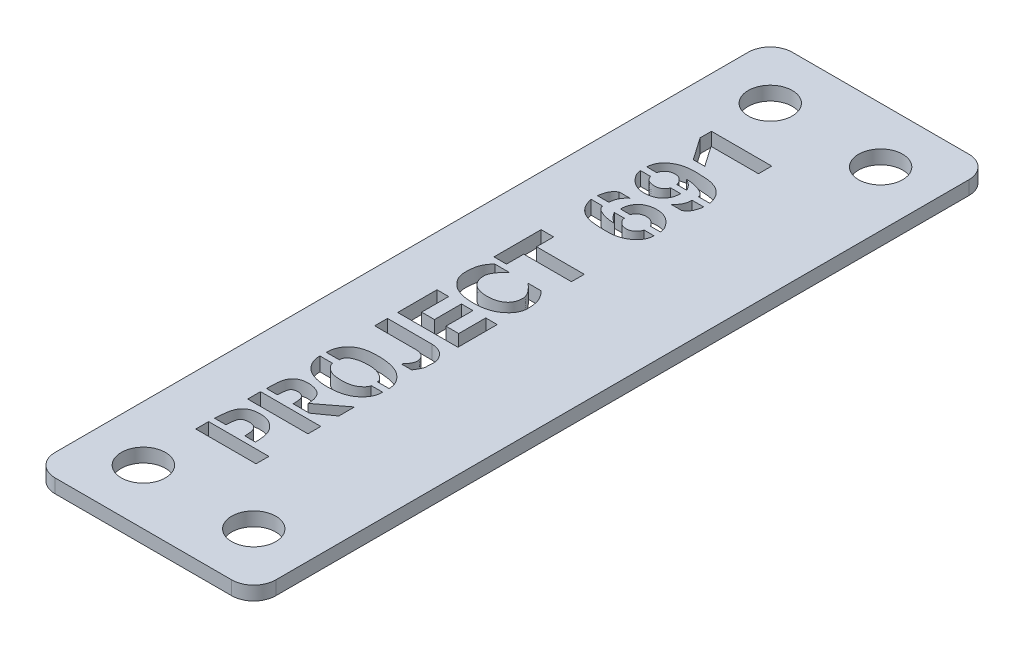
from build123d import *

# Parameters (mm, degrees)
SKETCH1_W           = 25.4
SKETCH1_H           = 84.836
BOSS_EXTRUDE1_DEPTH = 1.5875
FILLET1_R           = 2.54
SKETCH2_R           = 2.54
CUT_EXTRUDE1_DEPTH  = 4.7625
SKETCH3_W           = 6.937209635
SKETCH3_H           = 1.47773099
SKETCH3_H_2         = 1.477730989
CUT_EXTRUDE3_DEPTH  = 4.7625


with BuildPart() as part:
    # Sketch1 → Boss-Extrude1 (new body)
    with BuildSketch(Plane(origin=(0, 0, 0), x_dir=(1, 0, 0), z_dir=(0, 1, 0))):
        Rectangle(SKETCH1_W, SKETCH1_H)
    extrude(amount=BOSS_EXTRUDE1_DEPTH)

    # Fillet1
    fillet1_edges = [part.edges().sort_by_distance(p)[0] for p in [
        (-12.7, 0.79375, -42.418),
        (12.7, 0.79375, -42.418),
        (12.7, 0.79375, 42.418),
        (-12.7, 0.79375, 42.418),
    ]]
    fillet(fillet1_edges, radius=FILLET1_R)

    # Sketch2 → Cut-Extrude1 (cut)
    with BuildSketch(Plane(origin=(0, 1.5875, 0), x_dir=(1, 0, 0), z_dir=(0, 1, 0))):
        with Locations(Location((6.35, 36.068, 0), (0, 0, 270))):
            Circle(SKETCH2_R)
        with Locations(Location((-6.35, 36.068, 0), (0, 0, 270))):
            Circle(SKETCH2_R)
        with Locations(Location((6.35, -36.068, 0), (0, 0, 270))):
            Circle(SKETCH2_R)
        with Locations(Location((-6.35, -36.068, 0), (0, 0, 270))):
            Circle(SKETCH2_R)
    extrude(amount=-CUT_EXTRUDE1_DEPTH, mode=Mode.SUBTRACT)

    # Sketch3 → Cut-Extrude3 (cut)
    with BuildSketch(Plane(origin=(0, 1.5875, 0), x_dir=(1, 0, 0), z_dir=(0, 1, 0))):
        with BuildLine():
            Line((-2.204557943, -27.318811646), (-3.432489193, -27.318811646))
            add(Edge.make_bspline(
                [(-3.432489193, -27.318811646), (-3.432086244, -27.242043489), (-3.43131662, -27.095417788), (-3.444434951, -26.885090985), (-3.462893716, -26.694079451), (-3.490651172, -26.521824011), (-3.529286887, -26.369068947), (-3.578036003, -26.235963855), (-3.631503271, -26.119599112), (-3.700606609, -26.024876261), (-3.774751798, -25.94326573), (-3.859309551, -25.875236157), (-3.951313004, -25.81606595), (-4.052326275, -25.767662454), (-4.162419043, -25.732227657), (-4.279993593, -25.704130858), (-4.407280254, -25.690675175), (-4.539497775, -25.684071819), (-4.67120632, -25.68931151), (-4.795938487, -25.700663902), (-4.911135214, -25.720321161), (-5.01728325, -25.746758344), (-5.113551653, -25.782898874), (-5.20018799, -25.826377302), (-5.276644926, -25.878356426), (-5.345910846, -25.939667647), (-5.405748322, -26.021181454), (-5.455121107, -26.126788682), (-5.500796447, -26.257094486), (-5.534324196, -26.415150462), (-5.566678309, -26.59815323), (-5.589264627, -26.808329507), (-5.607848058, -27.044153478), (-5.613179732, -27.210425561), (-5.615979687, -27.297744198)],
                knots=[0, 0, 0, 0, 1.620059853, 3.094283102, 4.446036624, 5.669764395, 6.774058916, 7.765531304, 8.660548686, 9.465545705, 10.229819932, 10.982267153, 11.748884886, 12.535069155, 13.338672239, 14.18627352, 15.081979594, 16.035876351, 16.978779197, 17.861689262, 18.67809544, 19.443395835, 20.167134492, 20.8442956, 21.484521806, 22.114153355, 22.787578946, 23.602060283, 24.566476989, 25.696612031, 27.007394411, 28.488900441, 30.156128049, 32, 32, 32, 32], degree=3))
            Line((-5.615979687, -27.297744198), (-6.926675911, -27.297744198))
            add(Edge.make_bspline(
                [(-6.926675911, -27.297744198), (-6.921712564, -27.18334754), (-6.912149702, -26.962939926), (-6.889474751, -26.645831121), (-6.861772416, -26.354612775), (-6.825780895, -26.090107298), (-6.783941902, -25.851579213), (-6.736724336, -25.638719824), (-6.681792385, -25.45199614), (-6.619050018, -25.289274235), (-6.549930048, -25.145269935), (-6.475368605, -25.013851842), (-6.391670351, -24.895266674), (-6.304488565, -24.785514263), (-6.20972416, -24.687152478), (-6.106551853, -24.601539985), (-5.998363784, -24.525480797), (-5.84144082, -24.439916569), (-5.624638239, -24.353975928), (-5.338004568, -24.280368922), (-5.019882446, -24.239015253), (-4.73772238, -24.225933909), (-4.503107017, -24.233735716), (-4.327486567, -24.249429272), (-4.156796234, -24.278965653), (-3.990195633, -24.3168429), (-3.8297448, -24.371191099), (-3.672415085, -24.431572528), (-3.521002812, -24.506675475), (-3.374664778, -24.591583863), (-3.235441884, -24.686356673), (-3.104154991, -24.787205163), (-2.981621264, -24.89435255), (-2.868204891, -25.008408891), (-2.766398735, -25.131578913), (-2.670787271, -25.258608179), (-2.586590412, -25.394214474), (-2.508470134, -25.536587596), (-2.43904046, -25.693136489), (-2.382088863, -25.868028067), (-2.330052116, -26.061697568), (-2.28953676, -26.275159671), (-2.254184606, -26.507963608), (-2.229965258, -26.760683599), (-2.211124708, -27.033142019), (-2.206795653, -27.221466011), (-2.204557943, -27.318811646)],
                knots=[0, 0, 0, 0, 1.699189764, 3.273822559, 4.717445749, 6.039702003, 7.234168391, 8.310453345, 9.273716079, 10.119740721, 10.895518061, 11.642474635, 12.359027655, 13.047258987, 13.721088708, 14.381587928, 15.034110984, 15.680490903, 17.029629755, 18.483046039, 20.061106175, 21.782264105, 22.668591867, 23.543372224, 24.396343774, 25.237738208, 26.075767183, 26.907923794, 27.736877995, 28.580804131, 29.416979643, 30.23438941, 31.03619414, 31.831023051, 32.618286661, 33.405866943, 34.188612909, 34.984695714, 35.814585228, 36.725577301, 37.711441232, 38.788832536, 39.947912176, 41.204878494, 42.555187395, 44, 44, 44, 44], degree=3))
        make_face()
        with Locations((-3.468604818, -28.712272844)):
            Rectangle(SKETCH3_W, SKETCH3_H)
        with Locations((-3.468604818, -22.741156178)):
            Rectangle(SKETCH3_W, SKETCH3_H_2)
        with BuildLine():
            add(Edge.make_bspline(
                [(-3.84781888, -21.337161256), (-3.847753872, -21.265926003), (-3.847629287, -21.129407572), (-3.856412298, -20.93355259), (-3.873130803, -20.756378239), (-3.89422301, -20.597685736), (-3.925514345, -20.458660199), (-3.964855298, -20.338957205), (-4.008862139, -20.236185284), (-4.063781239, -20.151428397), (-4.128253534, -20.083185163), (-4.195373034, -20.020966344), (-4.273923765, -19.972273328), (-4.358233929, -19.928678985), (-4.451978172, -19.898349054), (-4.552643244, -19.875213633), (-4.66106172, -19.862255319), (-4.774288702, -19.857911775), (-4.88643986, -19.862473824), (-4.992170249, -19.874073649), (-5.088903823, -19.893580882), (-5.176763692, -19.919831106), (-5.254934344, -19.956278497), (-5.322499717, -20.001998193), (-5.382848358, -20.053485938), (-5.434618007, -20.116041305), (-5.477796034, -20.195189439), (-5.513801737, -20.29396158), (-5.548974097, -20.41391277), (-5.577494774, -20.55710614), (-5.604854555, -20.722633409), (-5.626833921, -20.910969515), (-5.644452056, -21.121798523), (-5.65341092, -21.269924536), (-5.658114583, -21.34769498)],
                knots=[0, 0, 0, 0, 1.704020633, 3.265661473, 4.687782663, 5.960558721, 7.092940044, 8.090949425, 8.971855951, 9.760657708, 10.491171539, 11.213658047, 11.942593241, 12.693902549, 13.479411519, 14.291598235, 15.162311024, 16.087000325, 16.999698994, 17.845156185, 18.628829851, 19.357567475, 20.033937485, 20.682928481, 21.303797403, 21.926056331, 22.613721948, 23.449414641, 24.436762231, 25.60173672, 26.93927573, 28.450017959, 30.1361567, 32, 32, 32, 32], degree=3))
            Line((-5.658114583, -21.34769498), (-6.907113281, -21.34769498))
            add(Edge.make_bspline(
                [(-6.907113281, -21.34769498), (-6.90682114, -21.22980228), (-6.906261587, -21.003997057), (-6.894238821, -20.680482609), (-6.881787593, -20.38717533), (-6.856193437, -20.1249368), (-6.829476564, -19.892639907), (-6.793612056, -19.691165929), (-6.752510206, -19.519862307), (-6.68978001, -19.334857686), (-6.588099061, -19.139505957), (-6.442249963, -18.935053685), (-6.263862306, -18.767229212), (-6.060311779, -18.632384798), (-5.834664977, -18.53161419), (-5.593774188, -18.45675038), (-5.337194887, -18.413966326), (-5.069279876, -18.399775581), (-4.797286243, -18.412218728), (-4.527748811, -18.448112576), (-4.264957544, -18.509025033), (-4.051778129, -18.577795298), (-3.888464716, -18.647363989), (-3.773840392, -18.708883966), (-3.667821705, -18.780352169), (-3.569622631, -18.859951386), (-3.480426153, -18.949258895), (-3.399855969, -19.048142343), (-3.328371497, -19.156577345), (-3.240615154, -19.313216413), (-3.153034087, -19.528605262), (-3.080046601, -19.808970902), (-3.033969671, -20.11273115), (-3.028839124, -20.323744903), (-3.026188411, -20.432765813)],
                knots=[0, 0, 0, 0, 1.545689895, 2.960529795, 4.244762436, 5.394017444, 6.414580785, 7.309945393, 8.075641602, 8.72251512, 9.866752923, 10.949451079, 12.000892828, 13.058917368, 14.136147873, 15.230450672, 16.35823801, 17.537386422, 18.742157286, 19.923486542, 21.0977639, 22.274984682, 22.855342685, 23.423306737, 23.977859707, 24.529479651, 25.078269143, 25.629889087, 26.199032476, 26.779092248, 27.98221028, 29.234586207, 30.571240389, 32, 32, 32, 32], degree=3))
            Line((-3.026188411, -20.432765813), (0, -18.122870631))
            Line((0, -18.122870631), (0, -19.933166334))
            Line((0, -19.933166334), (-1.986359375, -21.337161256))
            Line((-1.986359375, -21.337161256), (-3.84781888, -21.337161256))
        make_face()
        with BuildLine():
            add(Edge.make_bspline(
                [(-1.17526263, -14.302138469), (-1.176933137, -14.270320689), (-1.180340607, -14.205419324), (-1.211408481, -14.10939091), (-1.259105899, -14.013500009), (-1.324990391, -13.916470126), (-1.409867757, -13.818610025), (-1.514991417, -13.721397576), (-1.636947573, -13.622137312), (-1.775605988, -13.523710973), (-1.92952388, -13.430176335), (-2.099041038, -13.349129248), (-2.280756724, -13.280266035), (-2.47540848, -13.223881852), (-2.682505224, -13.183037248), (-2.902068659, -13.152836031), (-3.134201346, -13.134649564), (-3.375341466, -13.131311582), (-3.61626525, -13.137306834), (-3.848870711, -13.15140983), (-4.068120674, -13.177746639), (-4.275819162, -13.210050723), (-4.471102199, -13.252966051), (-4.653462371, -13.308176594), (-4.824324934, -13.368543178), (-4.980858056, -13.440815051), (-5.121393437, -13.521277307), (-5.245691328, -13.608116842), (-5.348101515, -13.705591479), (-5.434800426, -13.808282107), (-5.500001896, -13.920980862), (-5.545735921, -14.041376551), (-5.571841994, -14.169580802), (-5.57416518, -14.25737723), (-5.575349609, -14.302138469)],
                knots=[0, 0, 0, 0, 0.559551673, 1.141363957, 1.762179237, 2.443913102, 3.20250351, 4.040654274, 4.964481152, 5.97279125, 7.03575374, 8.135123237, 9.279679308, 10.457759393, 11.702785314, 12.996979229, 14.362738502, 15.804190176, 17.245831659, 18.610331059, 19.909950123, 21.136790735, 22.314472596, 23.430673126, 24.493525292, 25.506283696, 26.464789682, 27.34564422, 28.171296493, 28.950175142, 29.70690828, 30.454076609, 31.211842126, 32, 32, 32, 32], degree=3))
            Line((-5.575349609, -14.302138469), (-7.072643229, -14.302138469))
            add(Edge.make_bspline(
                [(-7.072643229, -14.302138469), (-7.070053996, -14.205688359), (-7.064974851, -14.016487887), (-7.024691446, -13.739763459), (-6.960781089, -13.476069688), (-6.868281915, -13.22693284), (-6.750778594, -12.991505893), (-6.604026538, -12.772136693), (-6.433764246, -12.565290762), (-6.236821326, -12.372530739), (-6.01076592, -12.197738151), (-5.750124588, -12.051409606), (-5.460800465, -11.924891132), (-5.13802578, -11.827830796), (-4.785007759, -11.750581216), (-4.399835445, -11.701093834), (-3.983692041, -11.674714797), (-3.546103019, -11.672385111), (-3.107073646, -11.692760084), (-2.686691187, -11.734918395), (-2.295496895, -11.802582549), (-1.933081824, -11.892281141), (-1.59861989, -12.004436696), (-1.292824692, -12.141467058), (-1.015849258, -12.302270854), (-0.770312417, -12.486814989), (-0.554714903, -12.686293548), (-0.36247581, -12.891080884), (-0.204973892, -13.108560267), (-0.070943722, -13.330171343), (0.029185523, -13.562592647), (0.105113723, -13.801550129), (0.146968569, -14.049869881), (0.153311394, -14.217727225), (0.156501042, -14.302138469)],
                knots=[0, 0, 0, 0, 0.920346871, 1.805389965, 2.663603329, 3.505921104, 4.336769663, 5.169437479, 6.019773897, 6.889978583, 7.795002015, 8.738717905, 9.735886095, 10.803615248, 11.950360416, 13.182160892, 14.506515913, 15.928648215, 17.357110269, 18.700219705, 19.958946806, 21.143485947, 22.260957422, 23.321793063, 24.336827028, 25.311708212, 26.247066261, 27.138304861, 27.987778048, 28.805680415, 29.605441448, 30.397525795, 31.194155961, 32, 32, 32, 32], degree=3))
            Line((0.156501042, -14.302138469), (-1.17526263, -14.302138469))
        make_face()
        with BuildLine():
            add(Edge.make_bspline(
                [(0.156501042, -15.03047024), (0.153682672, -15.1199529), (0.148104172, -15.297069145), (0.101349859, -15.557277814), (0.026212212, -15.80828382), (-0.082116267, -16.048061729), (-0.218545806, -16.279332634), (-0.386976583, -16.498830253), (-0.584534167, -16.709478238), (-0.810458157, -16.908603269), (-1.065092754, -17.090834972), (-1.346085708, -17.250971347), (-1.653418937, -17.38507378), (-1.98612729, -17.492130722), (-2.343135439, -17.578387266), (-2.725502238, -17.639413191), (-3.133326905, -17.67454055), (-3.556880155, -17.685710937), (-3.978977862, -17.67481494), (-4.381566132, -17.638977775), (-4.756468423, -17.581251044), (-5.103159616, -17.499520659), (-5.421722405, -17.392494242), (-5.711549193, -17.262130559), (-5.973515335, -17.107787394), (-6.205448706, -16.929811976), (-6.408609528, -16.733376267), (-6.58593024, -16.524578273), (-6.737467082, -16.304868716), (-6.860372979, -16.072456399), (-6.955862639, -15.828611624), (-7.023367495, -15.572644415), (-7.065142939, -15.3052195), (-7.070119512, -15.122918576), (-7.072643229, -15.03047024)],
                knots=[0, 0, 0, 0, 0.853788275, 1.689933833, 2.515604473, 3.349525323, 4.195487693, 5.073811264, 5.985247159, 6.948898209, 7.944298668, 8.969549936, 10.03104821, 11.139619114, 12.302323729, 13.534477937, 14.832609361, 16.207589621, 17.577782735, 18.861604178, 20.063875084, 21.196402976, 22.258020076, 23.267502423, 24.225161109, 25.154278776, 26.051819322, 26.918259964, 27.765739173, 28.594805511, 29.42276458, 30.260307849, 31.117768349, 32, 32, 32, 32], degree=3))
            Line((-7.072643229, -15.03047024), (-5.596417057, -15.03047024))
            add(Edge.make_bspline(
                [(-5.596417057, -15.03047024), (-5.59418075, -15.063796608), (-5.589630293, -15.131609384), (-5.558360923, -15.231422111), (-5.515055036, -15.332306207), (-5.451762082, -15.431565785), (-5.372985397, -15.531242211), (-5.276876069, -15.630499075), (-5.165845271, -15.731248558), (-5.038232395, -15.830259566), (-4.894168149, -15.924618009), (-4.730936409, -16.004564907), (-4.55257462, -16.074781774), (-4.357017638, -16.128804518), (-4.145897111, -16.175601915), (-3.917067755, -16.203045001), (-3.672661376, -16.223892169), (-3.416924159, -16.22838678), (-3.16077646, -16.223552934), (-2.91399163, -16.204200131), (-2.682886983, -16.171123665), (-2.466737835, -16.127075987), (-2.266854536, -16.067430889), (-2.08132654, -15.997918566), (-1.911297476, -15.913275878), (-1.758987956, -15.815372223), (-1.624246377, -15.712317058), (-1.505022047, -15.610972656), (-1.404417058, -15.511199701), (-1.321562253, -15.412104382), (-1.256175433, -15.315267527), (-1.210055351, -15.219007303), (-1.180810879, -15.124473852), (-1.177079775, -15.061258001), (-1.17526263, -15.03047024)],
                knots=[0, 0, 0, 0, 0.586688794, 1.193799336, 1.831051319, 2.517875258, 3.260615898, 4.067157841, 4.949574073, 5.90085298, 6.911050796, 7.978417371, 9.097950677, 10.284242926, 11.549887516, 12.905094796, 14.34172073, 15.871388074, 17.409892715, 18.855330142, 20.230456225, 21.522043046, 22.738739217, 23.902689247, 25.009587917, 26.078746574, 27.088247994, 27.99718535, 28.834762146, 29.581751398, 30.270676851, 30.887491563, 31.458179498, 32, 32, 32, 32], degree=3))
            Line((-1.17526263, -15.03047024), (0.156501042, -15.03047024))
        make_face()
        with BuildLine():
            Line((-6.926675911, -8.874260995), (-6.926675911, -7.396530006))
            Line((-6.926675911, -7.396530006), (-1.810295703, -7.40706373))
            add(Edge.make_bspline(
                [(-1.810295703, -7.40706373), (-1.737491363, -7.41052985), (-1.594878071, -7.417319483), (-1.386499947, -7.445032674), (-1.190774984, -7.493028043), (-1.004816741, -7.551940229), (-0.831688895, -7.631543927), (-0.667975095, -7.724305188), (-0.516521254, -7.835432556), (-0.378172376, -7.960777291), (-0.25412853, -8.096328746), (-0.143167563, -8.235530312), (-0.05141616, -8.380838461), (0.024520868, -8.528792311), (0.084108043, -8.680887215), (0.12645489, -8.837251454), (0.150201643, -8.99790952), (0.160156589, -9.20874337), (0.153890153, -9.45467783), (0.146907522, -9.720699429), (0.131465329, -9.943996328), (0.115783383, -10.107177103), (0.090863992, -10.227974972), (0.057980888, -10.324364871), (0.012549682, -10.432105779), (-0.045635935, -10.551906857), (-0.115460621, -10.683485682), (-0.201493097, -10.825532778), (-0.298437732, -10.979808985), (-0.369393692, -11.085527797), (-0.406300781, -11.140516464)],
                knots=[0, 0, 0, 0, 1.215774492, 2.38152841, 3.499943313, 4.574381322, 5.630576831, 6.672721368, 7.70883401, 8.757576902, 9.782134528, 10.77153606, 11.723382411, 12.644074726, 13.542320429, 14.443640527, 15.340755012, 16.245951772, 17.961585553, 19.443669169, 20.685038119, 21.696074975, 22.17535241, 22.739034778, 23.391781445, 24.125402853, 24.96028863, 25.875946883, 26.89519331, 28, 28, 28, 28], degree=3))
            Line((-0.406300781, -11.140516464), (-1.611659766, -11.140516464))
            add(Edge.make_bspline(
                [(-1.611659766, -11.140516464), (-1.555645054, -11.078522913), (-1.448822709, -10.960298677), (-1.308906829, -10.779901208), (-1.189713752, -10.610321257), (-1.096478603, -10.447986801), (-1.024765342, -10.294953361), (-0.979608093, -10.149658065), (-0.953773005, -10.01284842), (-0.960902551, -9.846074019), (-0.998009172, -9.656944514), (-1.071881974, -9.451413305), (-1.1813056, -9.275221289), (-1.298666603, -9.153224388), (-1.406713319, -9.070208795), (-1.499099073, -9.017699508), (-1.60115052, -8.974763671), (-1.711287435, -8.936162059), (-1.831903376, -8.908199982), (-1.961795014, -8.889231691), (-2.100994033, -8.876914629), (-2.197006503, -8.87516594), (-2.246692839, -8.874260995)],
                knots=[0, 0, 0, 0, 1.52682091, 2.911709905, 4.170758681, 5.312664321, 6.330329213, 7.252596346, 8.089247554, 8.859715672, 10.287649864, 11.599132905, 12.830633069, 14.049885, 14.671597463, 15.31647816, 15.985924738, 16.693474089, 17.447450553, 18.244998475, 19.091788859, 20, 20, 20, 20], degree=3))
            Line((-2.246692839, -8.874260995), (-6.926675911, -8.874260995))
        make_face()
        Polygon((-6.9342, -6.224277011), (-6.9342, -1.699290162), (-5.585883333, -1.699290162), (-5.585883333, -4.809748365), (-4.114171615, -4.809748365), (-4.114171615, -1.699290162), (-2.792941667, -1.699290162), (-2.792941667, -4.809748365), (-1.321229948, -4.809748365), (-1.321229948, -1.699290162), (0, -1.699290162), (0, -6.224277011), align=None)
        with BuildLine():
            add(Edge.make_bspline(
                [(-0.842697917, 4.192071166), (-0.769155384, 4.11651892), (-0.623127453, 3.966500452), (-0.428226109, 3.721399238), (-0.259086872, 3.461441745), (-0.132648637, 3.234829883), (-0.047733057, 3.039675523), (0.007232967, 2.87911242), (0.054255663, 2.704721472), (0.091015358, 2.516010768), (0.12107844, 2.313702338), (0.142178703, 2.097237217), (0.1528624, 1.867244059), (0.159707987, 1.626778524), (0.147385278, 1.381060154), (0.099928562, 1.138647294), (0.020709213, 0.903047376), (-0.090344043, 0.675055398), (-0.231516128, 0.453788697), (-0.404676742, 0.240816424), (-0.609932145, 0.036006896), (-0.842400789, -0.161257333), (-1.102267116, -0.343066786), (-1.386043775, -0.503262375), (-1.69320913, -0.637433939), (-2.023236361, -0.744898813), (-2.374785527, -0.830773906), (-2.749026303, -0.892300224), (-3.145853845, -0.927323762), (-3.556880642, -0.938638188), (-3.965949957, -0.927603002), (-4.357625146, -0.89195761), (-4.723517118, -0.832736517), (-5.064457338, -0.74861917), (-5.379696315, -0.640294932), (-5.671176081, -0.509967095), (-5.936091205, -0.352707463), (-6.173623719, -0.171991912), (-6.382760992, 0.025535856), (-6.568631257, 0.22948743), (-6.723081502, 0.445205546), (-6.850134276, 0.668667619), (-6.95100804, 0.900372388), (-7.021642789, 1.140989481), (-7.064882009, 1.389977952), (-7.074850144, 1.642832456), (-7.071570956, 1.890868097), (-7.058179175, 2.127074934), (-7.044003615, 2.347762777), (-7.016911492, 2.551808091), (-6.987231377, 2.740710659), (-6.945184801, 2.912849843), (-6.902237168, 3.070867947), (-6.827899923, 3.257914716), (-6.719513587, 3.477719511), (-6.563606885, 3.728919105), (-6.379609839, 3.968979798), (-6.239341642, 4.117032031), (-6.168247786, 4.192071166)],
                knots=[0, 0, 0, 0, 1.142102602, 2.267788091, 3.386469574, 4.500532407, 5.075110759, 5.690534852, 6.337967116, 7.030899795, 7.772743646, 8.553780998, 9.38659623, 10.267348619, 11.16047737, 12.046381184, 12.93508228, 13.846776553, 14.787737289, 15.77335943, 16.815008932, 17.925831272, 19.073418424, 20.246596944, 21.451460151, 22.699425793, 24.003318156, 25.369697712, 26.805256227, 28.317037304, 29.823384826, 31.237291449, 32.575969623, 33.836339543, 35.037948929, 36.183770988, 37.29034247, 38.36882713, 39.411043808, 40.404177068, 41.354558347, 42.279605007, 43.185365136, 44.086628527, 44.991001142, 45.916383134, 46.824228694, 47.678758263, 48.480056567, 49.219686519, 49.908684965, 50.550801302, 51.139176072, 51.681260279, 52.729033148, 53.790965847, 54.880368043, 56, 56, 56, 56], degree=3))
            Line((-6.168247786, 4.192071166), (-4.451250781, 4.192071166))
            add(Edge.make_bspline(
                [(-4.451250781, 4.192071166), (-4.545595179, 4.108424617), (-4.726484314, 3.948046765), (-4.969959057, 3.699645969), (-5.174444541, 3.456039217), (-5.340277169, 3.217507363), (-5.468565723, 2.984886842), (-5.560088003, 2.757411227), (-5.611269613, 2.533819734), (-5.622588252, 2.316762554), (-5.603795688, 2.110828345), (-5.571478966, 1.915829236), (-5.522324346, 1.732301504), (-5.45372998, 1.561839046), (-5.370669601, 1.401816101), (-5.270009135, 1.253473736), (-5.149106912, 1.119692032), (-5.015364731, 0.995112517), (-4.864239579, 0.885138398), (-4.697531826, 0.790900478), (-4.517921002, 0.708306259), (-4.322534928, 0.644916536), (-4.113824759, 0.593685961), (-3.89112755, 0.555628488), (-3.653581358, 0.536057126), (-3.406908278, 0.528170842), (-3.159230082, 0.536086437), (-2.920295161, 0.555860089), (-2.695152433, 0.592511351), (-2.483448858, 0.641260841), (-2.285845645, 0.706472568), (-2.100909846, 0.784238604), (-1.93039185, 0.878163131), (-1.773170576, 0.984886379), (-1.631412505, 1.105021915), (-1.507014715, 1.23823385), (-1.400414858, 1.38430151), (-1.312302881, 1.542922335), (-1.238213506, 1.712616528), (-1.187010542, 1.895705891), (-1.15098072, 2.090096905), (-1.129858317, 2.295424925), (-1.136410198, 2.513113664), (-1.191731208, 2.737102226), (-1.282805687, 2.96796972), (-1.418077593, 3.202490392), (-1.591803852, 3.443661125), (-1.80770186, 3.688990614), (-2.060133584, 3.944944065), (-2.250865254, 4.107259202), (-2.35052526, 4.192071166)],
                knots=[0, 0, 0, 0, 1.644457997, 3.152964999, 4.532843094, 5.788876873, 6.936739459, 7.991466232, 8.977304869, 9.914492674, 10.81384118, 11.670143911, 12.49082873, 13.286722025, 14.062344171, 14.839152306, 15.617859763, 16.409734935, 17.219891492, 18.049372533, 18.904474348, 19.794249952, 20.724260177, 21.706421881, 22.73783236, 23.831091397, 24.924350434, 25.968796894, 26.956349637, 27.897549355, 28.799749926, 29.667551167, 30.510955973, 31.334947132, 32.142642367, 32.929717677, 33.707159434, 34.495267687, 35.292612216, 36.116837179, 36.96900467, 37.869495086, 38.806043048, 39.793335612, 40.862637167, 42.034641504, 43.314850825, 44.734359334, 46.293656371, 48, 48, 48, 48], degree=3))
            Line((-2.35052526, 4.192071166), (-0.842697917, 4.192071166))
        make_face()
        Polygon((-6.9342, 4.855695776), (-6.9342, 10.285078067), (-5.489575, 10.285078067), (-5.489575, 8.318281322), (0, 8.318281322), (0, 6.842055151), (-5.489575, 6.842055151), (-5.489575, 4.855695776), align=None)
        with BuildLine():
            add(Edge.make_bspline(
                [(-5.751413281, 16.907780802), (-5.749215461, 16.984683116), (-5.74488097, 17.136348105), (-5.70701531, 17.358732387), (-5.648874903, 17.573241165), (-5.563726077, 17.77962671), (-5.450960019, 17.97869527), (-5.308881161, 18.17089911), (-5.139007888, 18.358207246), (-5.007807394, 18.471628998), (-4.940316536, 18.529974291)],
                knots=[0, 0, 0, 0, 0.981416672, 1.935527552, 2.872649936, 3.814794331, 4.77857579, 5.786904786, 6.861561505, 8, 8, 8, 8], degree=3))
            Line((-4.940316536, 18.529974291), (-6.189315234, 18.529974291))
            add(Edge.make_bspline(
                [(-6.189315234, 18.529974291), (-6.230373017, 18.504535397), (-6.311612887, 18.45420018), (-6.424654108, 18.368315422), (-6.526412863, 18.274750497), (-6.619783282, 18.176689433), (-6.701110714, 18.070265007), (-6.773516088, 17.957728936), (-6.835253885, 17.838023673), (-6.902918196, 17.675950201), (-6.965375757, 17.480249218), (-7.025977085, 17.265418812), (-7.063575025, 17.077615935), (-7.069797312, 16.961080967), (-7.072643229, 16.907780802)],
                knots=[0, 0, 0, 0, 0.902701417, 1.786149687, 2.649151757, 3.485131382, 4.314244312, 5.149329194, 5.984045373, 6.828816213, 8.430272808, 9.820342073, 11.003079253, 12, 12, 12, 12], degree=3))
            Line((-7.072643229, 16.907780802), (-5.751413281, 16.907780802))
        make_face()
        with BuildLine():
            add(Edge.make_bspline(
                [(-3.275988151, 16.907780802), (-3.271472985, 16.936853378), (-3.260925134, 17.004769637), (-3.19995319, 17.108849219), (-3.105417788, 17.226292967), (-3.007471412, 17.335577247), (-2.909610972, 17.422526039), (-2.825854647, 17.482904508), (-2.733495927, 17.532921439), (-2.635019648, 17.575186594), (-2.528326882, 17.606567263), (-2.415006009, 17.6290616), (-2.294174951, 17.642431342), (-2.168467067, 17.64633171), (-2.041991202, 17.643202597), (-1.919781218, 17.625795255), (-1.803510134, 17.600348247), (-1.692524289, 17.566274453), (-1.588519672, 17.519540467), (-1.491766882, 17.460917003), (-1.399090162, 17.395744068), (-1.317085632, 17.318728261), (-1.243137862, 17.242191786), (-1.176254385, 17.172609945), (-1.119156261, 17.111268204), (-1.071971018, 17.057882167), (-1.037371693, 17.010659545), (-1.011940058, 16.972760331), (-0.992370219, 16.943626411), (-0.989726183, 16.924488858), (-0.988665234, 16.916809708)],
                knots=[0, 0, 0, 0, 0.848617324, 1.982449431, 3.436545942, 5.240768766, 6.231652679, 7.234248317, 8.231856677, 9.276340032, 10.341049835, 11.455338972, 12.628184927, 13.867293084, 15.106401241, 16.297295494, 17.446097863, 18.561148647, 19.663179848, 20.747543236, 21.843297207, 22.946771928, 24.007887427, 24.935260928, 25.749674447, 26.44180137, 27.004159656, 27.444606052, 27.777142173, 28, 28, 28, 28], degree=3))
            Line((-0.988665234, 16.916809708), (0.156501042, 16.916809708))
            add(Edge.make_bspline(
                [(0.156501042, 16.916809708), (0.154509189, 16.970144389), (0.150450726, 17.078815523), (0.115381471, 17.241517099), (0.060283162, 17.405741311), (-0.015776273, 17.572203299), (-0.113863452, 17.740299816), (-0.234505949, 17.909367015), (-0.374596287, 18.081403886), (-0.535087588, 18.251193317), (-0.708905864, 18.415102084), (-0.899419935, 18.5562271), (-1.099760707, 18.676827436), (-1.310994886, 18.774098075), (-1.532330797, 18.852339967), (-1.764698968, 18.905335891), (-2.007358557, 18.939285958), (-2.256243642, 18.948392518), (-2.503095447, 18.939244307), (-2.739776194, 18.91476061), (-2.962432497, 18.871076079), (-3.171253776, 18.809587888), (-3.365735094, 18.729619432), (-3.546572364, 18.633426101), (-3.711314326, 18.517667221), (-3.862241262, 18.387123025), (-3.995702326, 18.241039595), (-4.112536564, 18.083130344), (-4.212656202, 17.914711059), (-4.291786984, 17.733748737), (-4.356565307, 17.543341129), (-4.398432169, 17.340587606), (-4.426951015, 17.127792167), (-4.430087576, 16.982117853), (-4.431688151, 16.907780802)],
                knots=[0, 0, 0, 0, 0.750355394, 1.528873324, 2.332989369, 3.186468007, 4.101149326, 5.069252908, 6.10844306, 7.222788785, 8.357455092, 9.46783137, 10.554430822, 11.644697357, 12.737066891, 13.854162738, 14.99494648, 16.182633948, 17.355930564, 18.471372678, 19.529710703, 20.546576165, 21.531666437, 22.486067545, 23.424654872, 24.360900384, 25.290755979, 26.204782513, 27.123029643, 28.043176503, 28.981311889, 29.949724638, 30.953752245, 32, 32, 32, 32], degree=3))
            Line((-4.431688151, 16.907780802), (-3.275988151, 16.907780802))
        make_face()
        with BuildLine():
            Line((0.167034766, 16.168915307), (-0.97813151, 16.168915307))
            add(Edge.make_bspline(
                [(-0.97813151, 16.168915307), (-0.984082939, 16.127663033), (-0.997128094, 16.037240664), (-1.068436363, 15.901983661), (-1.170099069, 15.752746028), (-1.281787375, 15.624164081), (-1.386338389, 15.521185154), (-1.475638921, 15.451851781), (-1.571433815, 15.394212714), (-1.673085329, 15.344341061), (-1.782004596, 15.309950765), (-1.896270635, 15.280876287), (-2.017634672, 15.267960547), (-2.142856443, 15.260527576), (-2.267604273, 15.267843524), (-2.388407862, 15.281087241), (-2.5018066, 15.309665508), (-2.609593915, 15.344470672), (-2.709650926, 15.393692859), (-2.802867691, 15.452904924), (-2.891749874, 15.52021824), (-2.993216817, 15.625202735), (-3.102060302, 15.756815566), (-3.202031108, 15.913828071), (-3.267785111, 16.06333098), (-3.280542409, 16.162883959), (-3.286521875, 16.209545385)],
                knots=[0, 0, 0, 0, 0.927475074, 2.032966586, 3.375798686, 4.976803487, 5.834806498, 6.659437564, 7.501332334, 8.335396756, 9.187940833, 10.054359069, 10.971160572, 11.915823181, 12.860485791, 13.766139725, 14.632557961, 15.474452731, 16.298394914, 17.121187677, 17.945818743, 18.787788451, 20.384333895, 21.761999943, 22.951028129, 24, 24, 24, 24], degree=3))
            Line((-3.286521875, 16.209545385), (-4.431688151, 16.209545385))
            add(Edge.make_bspline(
                [(-4.431688151, 16.209545385), (-4.43033138, 16.204965798), (-4.42634918, 16.191524452), (-4.410990235, 16.168396225), (-4.390429985, 16.132468079), (-4.358273424, 16.08724439), (-4.319164159, 16.029249096), (-4.271234281, 15.960347427), (-4.213804932, 15.880762977), (-4.12510099, 15.757919093), (-3.992306514, 15.598975766), (-3.79642281, 15.422596807), (-3.566834061, 15.255251892), (-3.396441555, 15.158480741), (-3.307589323, 15.108018822)],
                knots=[0, 0, 0, 0, 0.107234925, 0.314740585, 0.61909808, 1.04234032, 1.562795012, 2.196197582, 2.933359156, 3.774392159, 5.611037011, 7.587220186, 9.698928515, 12, 12, 12, 12], degree=3))
            add(Edge.make_bspline(
                [(-3.307589323, 15.108018822), (-3.396427634, 15.112798938), (-3.570352881, 15.122157319), (-3.824272558, 15.148294809), (-4.065220443, 15.181163702), (-4.292955134, 15.220999277), (-4.50712411, 15.271358881), (-4.709076494, 15.327404792), (-4.897600926, 15.394419445), (-5.072557629, 15.466538729), (-5.229319114, 15.546193307), (-5.368180131, 15.62702524), (-5.485450235, 15.711987446), (-5.581521697, 15.799714206), (-5.658009859, 15.88920577), (-5.710955481, 15.983298011), (-5.745343946, 16.080309135), (-5.749400759, 16.146575375), (-5.751413281, 16.179449031)],
                knots=[0, 0, 0, 0, 1.499814804, 2.936296909, 4.302182762, 5.59947636, 6.832403556, 8.010357135, 9.131089549, 10.20385637, 11.198577165, 12.09348467, 12.910514558, 13.634730622, 14.283349854, 14.885477346, 15.447102571, 16, 16, 16, 16], degree=3))
            Line((-5.751413281, 16.179449031), (-7.072643229, 16.189982755))
            add(Edge.make_bspline(
                [(-7.072643229, 16.189982755), (-7.072225471, 16.169353526), (-7.071322508, 16.124764522), (-7.056657178, 16.054402908), (-7.041915423, 15.973851223), (-7.014075207, 15.885295953), (-6.984383653, 15.785967725), (-6.94120358, 15.679532111), (-6.898092446, 15.561756348), (-6.825156149, 15.396185164), (-6.72127449, 15.188853674), (-6.567367539, 14.955532129), (-6.384238624, 14.743469374), (-6.176122517, 14.549426977), (-5.938986702, 14.378717066), (-5.671938824, 14.235130783), (-5.377551436, 14.116952243), (-5.110335629, 14.039099462), (-4.874872056, 13.99033156), (-4.673114958, 13.95718399), (-4.448577152, 13.930984579), (-4.201696527, 13.908620392), (-3.932288452, 13.890390059), (-3.640229995, 13.879015397), (-3.325687586, 13.872011874), (-2.995041466, 13.867164324), (-2.660435678, 13.876464036), (-2.334863018, 13.905259328), (-2.025691105, 13.958438047), (-1.732480793, 14.030777563), (-1.454188775, 14.12141925), (-1.193480651, 14.236890841), (-0.947945933, 14.370592503), (-0.722093029, 14.525538475), (-0.516341268, 14.693993268), (-0.336454436, 14.875137853), (-0.182463953, 15.065627116), (-0.057090941, 15.26690343), (0.042738645, 15.477551505), (0.11106089, 15.699686358), (0.156645934, 15.930834852), (0.16354514, 16.08894368), (0.167034766, 16.168915307)],
                knots=[0, 0, 0, 0, 0.258221721, 0.558132818, 0.898640276, 1.28488583, 1.720575915, 2.19841396, 2.72412238, 3.293240168, 4.466418006, 5.628394464, 6.788325788, 7.972365138, 9.18920409, 10.441809878, 11.765322105, 13.160831415, 13.925755206, 14.779982171, 15.724097867, 16.760064261, 17.888611064, 19.11002675, 20.425140591, 21.834293582, 23.256653412, 24.621237559, 25.92947289, 27.18665111, 28.406072673, 29.59473182, 30.757474276, 31.907297446, 33.024443337, 34.087556567, 35.103387964, 36.089590438, 37.054866171, 38.017802335, 38.997402139, 40, 40, 40, 40], degree=3))
        make_face()
        with BuildLine():
            Line((0.145967318, 21.900765958), (-1.17526263, 21.900765958))
            add(Edge.make_bspline(
                [(-1.17526263, 21.900765958), (-1.177505176, 21.823876114), (-1.181927875, 21.67223572), (-1.219172279, 21.449538092), (-1.279765212, 21.235571565), (-1.364329989, 21.028895771), (-1.477194531, 20.829802452), (-1.61935432, 20.6381586), (-1.787615358, 20.449836818), (-1.918763819, 20.336821814), (-1.986359375, 20.278572468)],
                knots=[0, 0, 0, 0, 0.981732815, 1.936151043, 2.87530384, 3.817751729, 4.781843651, 5.79049746, 6.86119478, 8, 8, 8, 8], degree=3))
            Line((-1.986359375, 20.278572468), (-0.738865495, 20.278572468))
            add(Edge.make_bspline(
                [(-0.738865495, 20.278572468), (-0.697772937, 20.303975459), (-0.61646426, 20.354239637), (-0.504194003, 20.440439298), (-0.400546562, 20.532094206), (-0.309654668, 20.632327809), (-0.224777199, 20.73626278), (-0.153477858, 20.849518801), (-0.090981036, 20.968610693), (-0.026354222, 21.131918856), (0.039361283, 21.326371051), (0.099379051, 21.542137812), (0.136812594, 21.730442469), (0.143102564, 21.847467266), (0.145967318, 21.900765958)],
                knots=[0, 0, 0, 0, 0.902130626, 1.785020279, 2.641190041, 3.483499652, 4.310496615, 5.14505346, 5.979241836, 6.819881233, 8.423313641, 9.812503944, 11.003709621, 12, 12, 12, 12], degree=3))
        make_face()
        with BuildLine():
            Line((-2.496492578, 21.900765958), (-3.65068776, 21.900765958))
            add(Edge.make_bspline(
                [(-3.65068776, 21.900765958), (-3.66087209, 21.86706198), (-3.683401725, 21.792502494), (-3.75358808, 21.683582261), (-3.845247914, 21.560797211), (-3.942901086, 21.456233997), (-4.033075561, 21.370188456), (-4.114186325, 21.315350734), (-4.201067173, 21.266170747), (-4.297738207, 21.228985272), (-4.401527199, 21.199300958), (-4.513047717, 21.175904295), (-4.633110229, 21.165142382), (-4.798419333, 21.159120606), (-4.998077375, 21.16995232), (-5.219055164, 21.207617209), (-5.411854946, 21.271659652), (-5.575684099, 21.362430476), (-5.708198852, 21.475862466), (-5.817849104, 21.599858222), (-5.899517838, 21.739318621), (-5.933185259, 21.839867469), (-5.950049219, 21.890232234)],
                knots=[0, 0, 0, 0, 0.715897332, 1.583698414, 2.622319798, 3.84739399, 4.499884924, 5.161953047, 5.840456042, 6.534702953, 7.270546337, 8.043928196, 8.85724736, 9.72842699, 11.421000357, 12.929892975, 14.293570183, 15.550098503, 16.727797181, 17.83879812, 18.917457273, 20, 20, 20, 20], degree=3))
            Line((-5.950049219, 21.890232234), (-7.093710677, 21.890232234))
            add(Edge.make_bspline(
                [(-7.093710677, 21.890232234), (-7.091726863, 21.836893881), (-7.087684778, 21.728215267), (-7.052487746, 21.565572051), (-6.997838565, 21.4009136), (-6.919550374, 21.235236861), (-6.821926549, 21.06672405), (-6.701219088, 20.897235167), (-6.559455475, 20.725715078), (-6.397652504, 20.555738883), (-6.222341163, 20.392452257), (-6.031619654, 20.250252812), (-5.830137328, 20.130706762), (-5.618358146, 20.032516483), (-5.396234635, 19.955017967), (-5.16350335, 19.901648531), (-4.920815742, 19.867770199), (-4.671940078, 19.858653595), (-4.425079995, 19.867767803), (-4.187931418, 19.892438899), (-3.964725147, 19.935803264), (-3.755783631, 19.99712822), (-3.562103964, 20.077808188), (-3.381596666, 20.173576551), (-3.216846958, 20.289369461), (-3.066028447, 20.419978621), (-2.93187292, 20.566070409), (-2.816659435, 20.72507808), (-2.714598074, 20.892833829), (-2.636852847, 21.074516958), (-2.571528744, 21.265162763), (-2.529772914, 21.467971197), (-2.501223231, 21.680751386), (-2.498090963, 21.826427823), (-2.496492578, 21.900765958)],
                knots=[0, 0, 0, 0, 0.749496382, 1.527123058, 2.330318545, 3.185763752, 4.099397937, 5.066393227, 6.108867918, 7.226779668, 8.365339679, 9.474444789, 10.565860266, 11.654878656, 12.752660777, 13.868477764, 15.007955528, 16.194283322, 17.366236738, 18.480401886, 19.544451134, 20.560152481, 21.537592667, 22.49090117, 23.428413994, 24.363587685, 25.292378774, 26.211038861, 27.122163358, 28.047706306, 28.984767707, 29.952071809, 30.954949998, 32, 32, 32, 32], degree=3))
        make_face()
        with BuildLine():
            add(Edge.make_bspline(
                [(-2.496492578, 22.586962833), (-2.511079468, 22.626513157), (-2.542310225, 22.711191013), (-2.612936437, 22.836384351), (-2.705431129, 22.967800965), (-2.816451039, 23.109732091), (-2.959992926, 23.256646931), (-3.14445029, 23.401072511), (-3.366833916, 23.548608932), (-3.531624736, 23.640972657), (-3.619086589, 23.689994213)],
                knots=[0, 0, 0, 0, 0.627447975, 1.343375806, 2.133407235, 3.021854083, 4.026238314, 5.185535451, 6.506237888, 8, 8, 8, 8], degree=3))
            add(Edge.make_bspline(
                [(-3.619086589, 23.689994213), (-3.530253171, 23.685184253), (-3.356835894, 23.675794428), (-3.103272669, 23.650151513), (-2.863086799, 23.614903755), (-2.635252061, 23.575478716), (-2.420773725, 23.525619397), (-2.219367848, 23.467177847), (-2.030560813, 23.400677649), (-1.855578222, 23.328522326), (-1.698650015, 23.248335452), (-1.559301628, 23.168800315), (-1.442177443, 23.083553891), (-1.345123029, 22.997335658), (-1.26923245, 22.907453059), (-1.215324234, 22.814446565), (-1.181391608, 22.717668704), (-1.177294929, 22.65142599), (-1.17526263, 22.618564005)],
                knots=[0, 0, 0, 0, 1.500803449, 2.929812407, 4.297777101, 5.595925846, 6.829665761, 8.010732737, 9.132203913, 10.205677879, 11.201054371, 12.103839975, 12.909584566, 13.64052655, 14.289573337, 14.884742677, 15.446738114, 16, 16, 16, 16], degree=3))
            Line((-1.17526263, 22.618564005), (0.145967318, 22.618564005))
            add(Edge.make_bspline(
                [(0.145967318, 22.618564005), (0.145365924, 22.638161768), (0.14404797, 22.681110266), (0.132508591, 22.750018815), (0.114366035, 22.828391251), (0.08807335, 22.915425887), (0.056467223, 23.012440631), (0.01731997, 23.118848641), (-0.029586014, 23.234671961), (-0.101277371, 23.400870937), (-0.204633208, 23.608660039), (-0.360291156, 23.841633036), (-0.542863849, 24.054173596), (-0.752517059, 24.246405197), (-0.987993821, 24.418868249), (-1.255719658, 24.560425718), (-1.549823404, 24.680336278), (-1.817419542, 24.757179356), (-2.053298302, 24.806206163), (-2.25506901, 24.839315015), (-2.479602578, 24.865526482), (-2.726484508, 24.887886959), (-2.995892184, 24.906118417), (-3.287950768, 24.917492759), (-3.602493106, 24.924496296), (-3.933139384, 24.929344179), (-4.267744614, 24.920043108), (-4.59331924, 24.891252654), (-4.902484263, 24.838056967), (-5.19571886, 24.765777268), (-5.474361673, 24.674779533), (-5.736181252, 24.559648798), (-5.983225371, 24.425944003), (-6.210496078, 24.270914753), (-6.417766622, 24.103003206), (-6.59815253, 23.920765029), (-6.752781486, 23.729963968), (-6.879578041, 23.527527961), (-6.977624716, 23.314418015), (-7.048588324, 23.091580901), (-7.093947449, 22.858627031), (-7.100771545, 22.699530134), (-7.104244401, 22.618564005)],
                knots=[0, 0, 0, 0, 0.245537621, 0.538095685, 0.873642495, 1.253663812, 1.677177559, 2.152586362, 2.674492895, 3.243335955, 4.421547503, 5.577726231, 6.745963606, 7.925164578, 9.136318501, 10.393849058, 11.710897004, 13.111770791, 13.876325334, 14.730139942, 15.673799889, 16.709266196, 17.83726822, 19.058094298, 20.3725733, 21.781046057, 23.202719277, 24.566644705, 25.874248518, 27.130819866, 28.349652783, 29.543497395, 30.711193199, 31.865660995, 32.987125248, 34.049725286, 35.07390531, 36.05963172, 37.035847219, 38.006213658, 38.985340585, 40, 40, 40, 40], degree=3))
            Line((-7.104244401, 22.618564005), (-5.950049219, 22.618564005))
            add(Edge.make_bspline(
                [(-5.950049219, 22.618564005), (-5.945932451, 22.661345596), (-5.936981638, 22.754362749), (-5.866028613, 22.892567756), (-5.766331782, 23.044498815), (-5.652436375, 23.172424303), (-5.546281813, 23.275977301), (-5.454333575, 23.343690028), (-5.358059276, 23.402872618), (-5.255383952, 23.451727377), (-5.145775351, 23.486901419), (-5.031324706, 23.515240242), (-4.910070821, 23.528709822), (-4.785320724, 23.535933648), (-4.660568191, 23.528716167), (-4.539321241, 23.515216392), (-4.425308944, 23.487100895), (-4.317089009, 23.45200941), (-4.217021437, 23.402824198), (-4.123815485, 23.343595764), (-4.034900235, 23.276311503), (-3.933863874, 23.171474118), (-3.82414091, 23.041085238), (-3.724713004, 22.884138078), (-3.658640731, 22.734237112), (-3.646076067, 22.6341407), (-3.640154036, 22.586962833)],
                knots=[0, 0, 0, 0, 0.950756861, 2.067167101, 3.407359861, 5.008861816, 5.871297013, 6.710200126, 7.548506473, 8.389122927, 9.238033191, 10.111638893, 11.013432643, 11.9540688, 12.894704957, 13.796498707, 14.670104409, 15.508410757, 16.328841036, 17.148126795, 17.969243021, 18.807623987, 20.388723309, 21.760517307, 22.944477478, 24, 24, 24, 24], degree=3))
            Line((-3.640154036, 22.586962833), (-2.496492578, 22.586962833))
        make_face()
        Polygon((-6.937209635, 29.889843171), (0, 29.889843171), (0, 28.36094838), (-5.460983464, 28.36094838), (-3.82825625, 26.010423119), (-5.14798138, 26.010423119), (-6.937209635, 28.579146947), align=None)
    extrude(amount=-CUT_EXTRUDE3_DEPTH, mode=Mode.SUBTRACT)


solid = part.part
